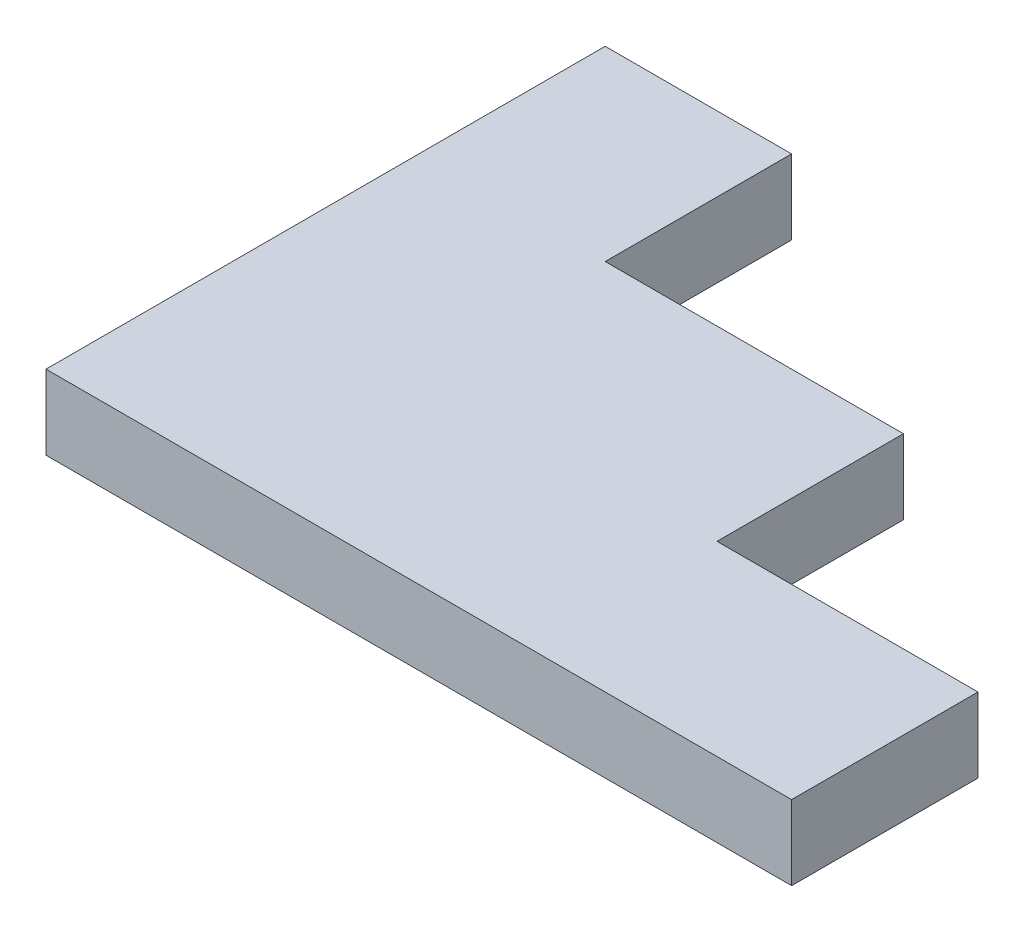
from build123d import *

# Parameters (mm, degrees)
BOSS_EXTRUDE1_DEPTH = 2


with BuildPart() as part:
    # Sketch1 → Boss-Extrude1 (new body)
    with BuildSketch(Plane(origin=(0, 0, 0), x_dir=(1, 0, 0), z_dir=(0, 1, 0))):
        Polygon((0, 0), (20, 0), (20, 5), (13, 5), (13, 10), (5, 10), (5, 15), (0, 15), align=None)
    extrude(amount=BOSS_EXTRUDE1_DEPTH)


solid = part.part
